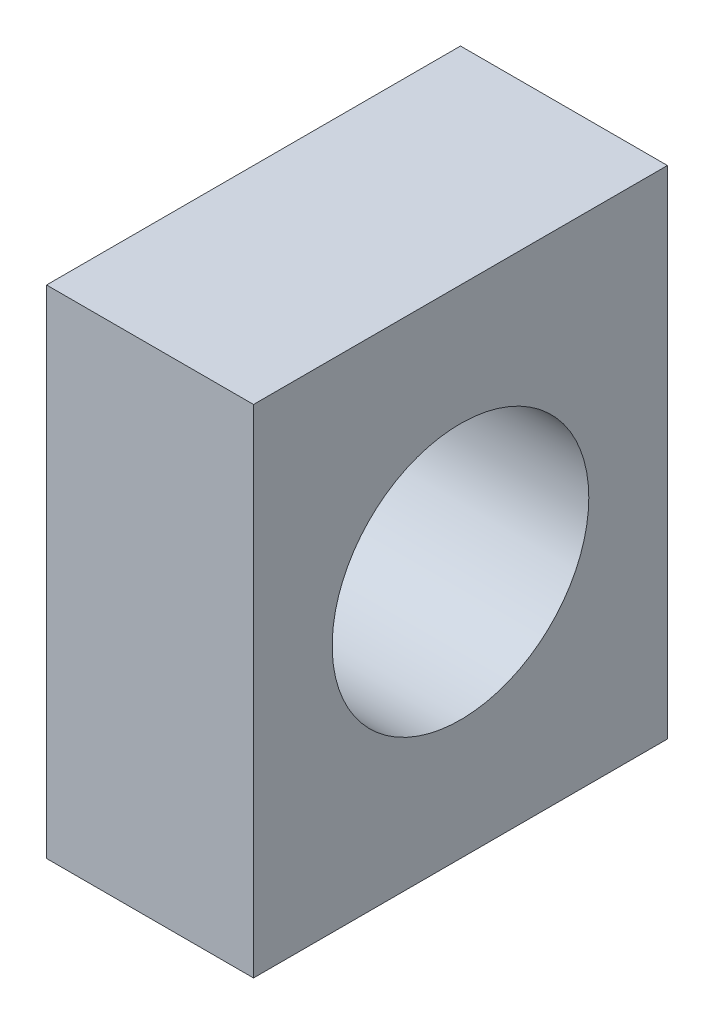
from build123d import *

# Parameters (mm, degrees)
SKETCH_1_W      = 10
SKETCH_1_H      = 12
SKETCH_1_R      = 3.1
EXTRUDE_1_DEPTH = 2.5


with BuildPart() as part:
    # Эскиз1 → Бобышка-Вытянуть1 (new, symmetric)
    with BuildSketch(Plane(origin=(0, 0, 0), x_dir=(0, 0, -1), z_dir=(1, 0, 0))):
        Rectangle(SKETCH_1_W, SKETCH_1_H)
        Circle(SKETCH_1_R, mode=Mode.SUBTRACT)
    extrude(amount=EXTRUDE_1_DEPTH, both=True)


solid = part.part
